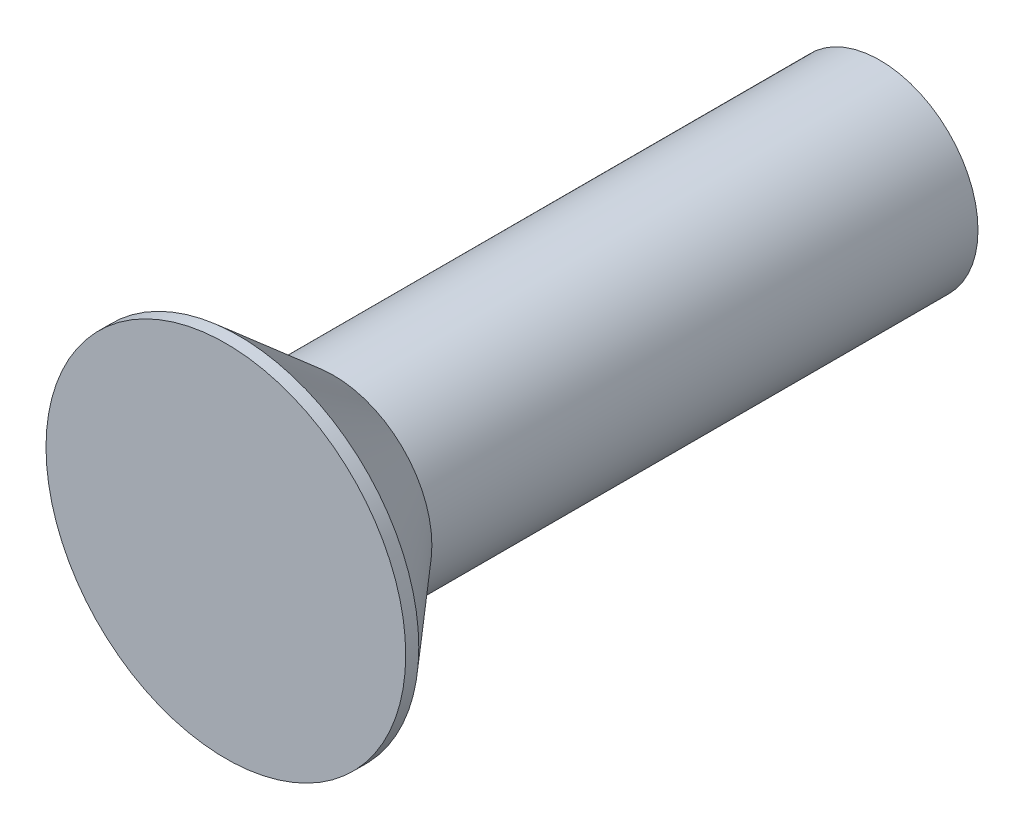
from build123d import *


with BuildPart() as part:
    # 草图1 → 旋转4 (revolve)
    with BuildSketch(Plane(origin=(0, 0, 0), x_dir=(0, 0, -1), z_dir=(1, 0, 0)), mode=Mode.PRIVATE) as revolve_4_sk:
        Polygon((-2.912452823, 2.75), (-1.462452823, 1.5), (6.887547177, 1.5), (6.887547177, 0), (-3.112452823, 0), (-3.112452823, 2.75), align=None)
    revolve(revolve_4_sk.sketch.rotate(Axis((0, 0, 5.35230681), (0, 0, -1)), 90), axis=Axis((0, 0, 5.35230681), (0, 0, -1)))


solid = part.part
